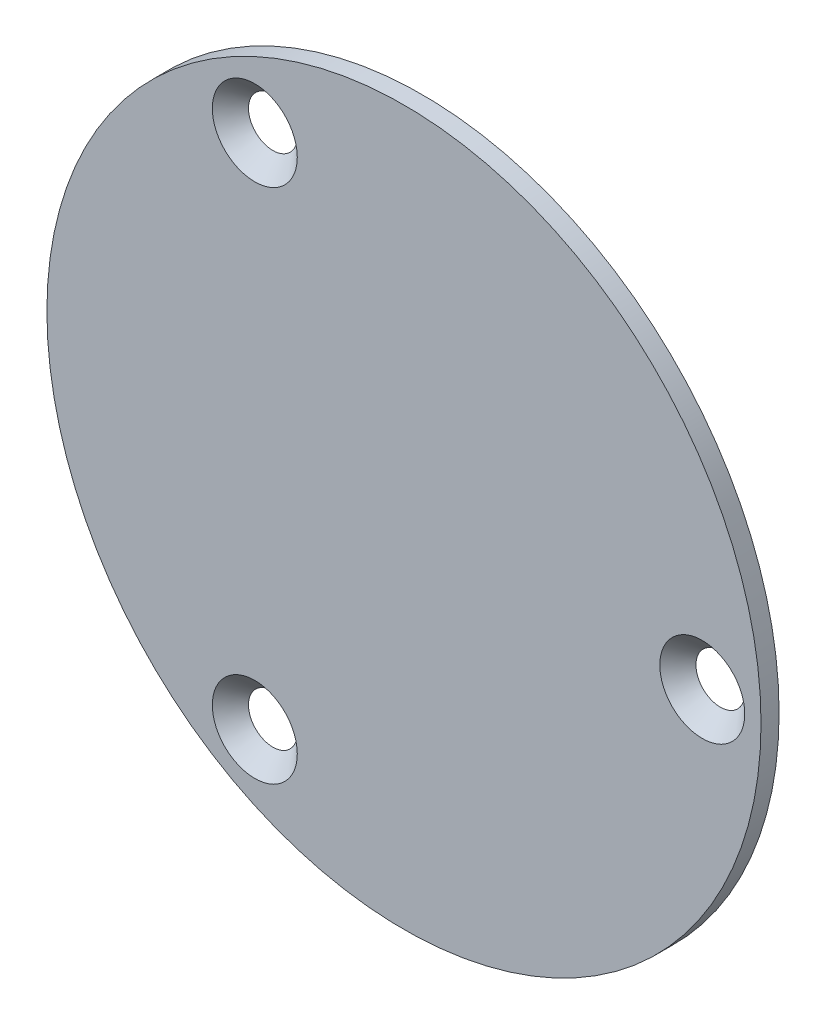
from build123d import *

# Parameters (mm, degrees)
SKETCH1_R           = 39.5
BOSS_EXTRUDE1_DEPTH = 2
CIRPATTERN1_COUNT   = 3


with BuildPart() as part:
    # Sketch1 → Boss-Extrude1 (new body)
    with BuildSketch(Plane.XY):
        Circle(SKETCH1_R)
    extrude(amount=BOSS_EXTRUDE1_DEPTH)

    # Sketch3 → CSK for M4 Flat Head Machine Screw1 (revolve, cut)
    with BuildSketch(Plane(origin=(33, 0, 2), x_dir=(0, -1, 0), z_dir=(1, 0, 0))):
        Polygon((0, 0), (0, 27.391936393), (2.25, 26.04), (2.25, 2.45), (4.7, 0), align=None)
    csk_for_m4_flat_head_machine_screw1 = revolve(axis=Axis((33, 0, 8.35), (0, 0, -1)), mode=Mode.SUBTRACT)

    # CirPattern1: CSK for M4 Flat Head Machine Screw1 ×3 about axis
    cirpattern1_axis = Axis((0, 0, 0), (0, 0, 1))
    for i in range(1, CIRPATTERN1_COUNT):
        add(csk_for_m4_flat_head_machine_screw1.rotate(cirpattern1_axis, i * 360 / CIRPATTERN1_COUNT), mode=Mode.SUBTRACT)


solid = part.part
